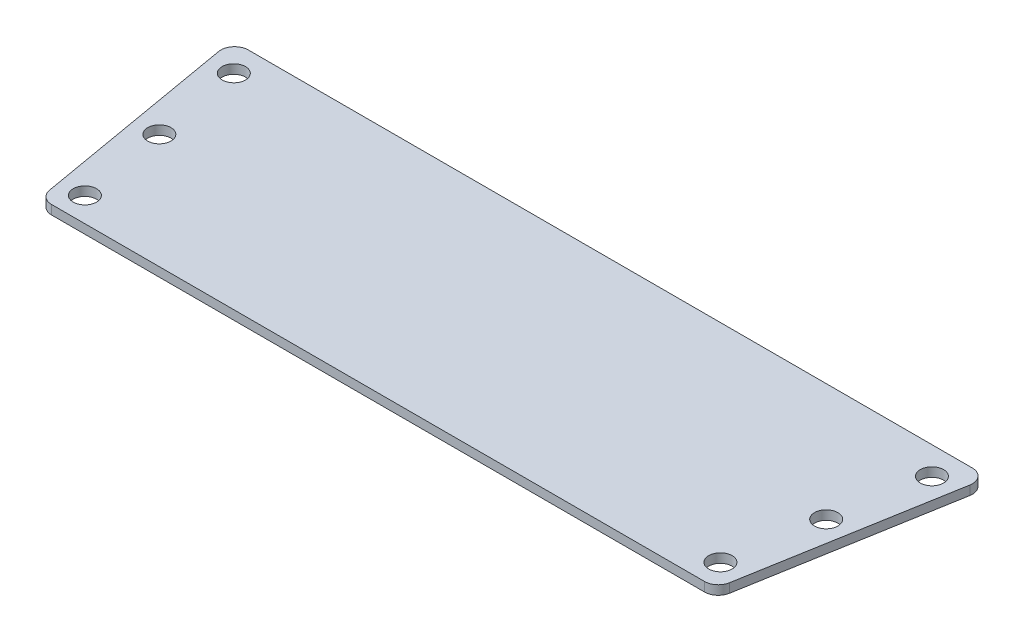
from build123d import *

# Parameters (mm, degrees)
SKETCH_1_W          = 200
SKETCH_1_H          = 60
EXTRUDE_1_DEPTH     = 2
SKETCH_3_R          = 2.55
CUT_EXTRUDE_1_DEPTH = 105.422219858
CUT_EXTRUDE_2_DEPTH = 96.828733232
SKETCH_5_R          = 17.5
CUT_EXTRUDE_3_DEPTH = 0.2
FILLET_1_R          = 3


with BuildPart() as part:
    # 草图1 → 凸台-拉伸1 (new body)
    with BuildSketch(Plane(origin=(0, 0, 0), x_dir=(1, 0, 0), z_dir=(0, 1, 0))):
        Rectangle(SKETCH_1_W, SKETCH_1_H)
    extrude(amount=EXTRUDE_1_DEPTH)

    # 草图3 → 切除-拉伸1 (cut, through all)
    with BuildSketch(Plane(origin=(0, 2, 0), x_dir=(1, 0, 0), z_dir=(0, 1, 0))):
        Polygon((82.173464202, -20.771330594), (-77.826535798, -20.771330594), (-86.642884834, 30), (-100, 30), (-100, -30), (100, -30), (100, 30), (90.989813237, 30), align=None)
        with Locations(Location((-74.153372817, 24, 0), (0, 0, 270))):
            Circle(SKETCH_3_R)
        with Locations(Location((-70.731615422, 4.294884514, 0), (0, 0, 270))):
            Circle(SKETCH_3_R)
        with Locations(Location((-67.309858027, -15.410230973, 0), (0, 0, 270))):
            Circle(SKETCH_3_R)
        with Locations(Location((78.50030122, 24, 0), (0, 0, 270))):
            Circle(SKETCH_3_R)
        with Locations(Location((71.65678643, -15.410230973, 0), (0, 0, 270))):
            Circle(SKETCH_3_R)
        with Locations(Location((75.078543825, 4.294884514, 0), (0, 0, 270))):
            Circle(SKETCH_3_R)
    extrude(amount=-CUT_EXTRUDE_1_DEPTH, mode=Mode.SUBTRACT)

    # 草图4 → 切除-拉伸2 (cut, through all)
    with BuildSketch(Plane.XZ):
        Polygon((76.083674975, 20.771330594), (84.90002401, -30), (90.989813237, -30), (82.173464202, 20.771330594), align=None)
        Polygon((-86.642884834, -30), (-80.553095607, -30), (-71.736746572, 20.771330594), (-77.826535798, 20.771330594), align=None)
    extrude(amount=-CUT_EXTRUDE_2_DEPTH, mode=Mode.SUBTRACT)

    # 草图5 → 切除-拉伸3 (cut)
    with BuildSketch(Plane.XZ):
        with Locations(Location((-6, -3, 0), (0, 0, 270))):
            Circle(SKETCH_5_R)
    extrude(amount=-CUT_EXTRUDE_3_DEPTH, mode=Mode.SUBTRACT)

    # 圆角1
    fillet_1_edges = [part.edges().sort_by_distance(p)[0] for p in [
        (-80.553095607, 1, -30),
        (-71.736746572, 1, 20.771330594),
        (84.90002401, 1, -30),
        (76.083674975, 1, 20.771330594),
    ]]
    fillet(fillet_1_edges, radius=FILLET_1_R)


solid = part.part
